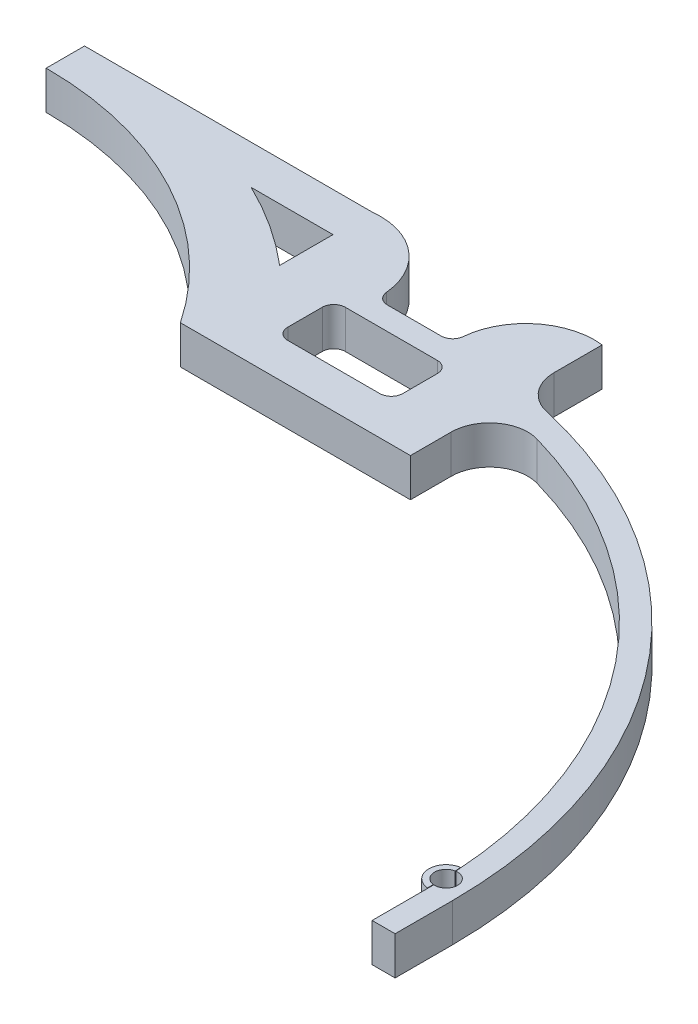
from build123d import *

# Parameters (mm, degrees)
BOSS_EXTRUDE1_DEPTH = 5
BOSS_EXTRUDE2_DEPTH = 10
SKETCH4_R           = 3
CUT_EXTRUDE2_DEPTH  = 7


with BuildPart() as part:
    # Sketch1 → Boss-Extrude1 (new, symmetric)
    with BuildSketch(Plane(origin=(0, 0, 0), x_dir=(1, 0, 0), z_dir=(0, 1, 0))):
        with BuildLine():
            Line((30, 145.200641517), (30, 132.64991519))
            ThreePointArc((30, 132.64991519), (32.187867656, 126.407272462), (37.794117647, 122.896244956))
            ThreePointArc((37.794117647, 122.896244956), (108.370209653, 78.735645376), (135.99984025, 0.200641517))
            Line((135.99984025, 0.200641517), (135.99984025, -14.799358483))
            Line((135.99984025, -14.799358483), (129.999832262, -14.799358483))
            Line((129.999832262, -14.799358483), (129.999832262, 0.200641517))
            ThreePointArc((129.999832262, 0.200641517), (105.666355059, 72.44272572), (42.727272727, 115.450966301))
            ThreePointArc((42.727272727, 115.450966301), (33.969773108, 113.807292795), (30, 105.830052443))
            Line((30, 105.830052443), (30, 95.200641517))
            Line((30, 95.200641517), (-30, 95.200641517))
            ThreePointArc((-30, 95.200641517), (-62.5, 124.575641517), (-105, 135.200641517))
            Line((-105, 135.200641517), (-105, 145.200641517))
            Line((-105, 145.200641517), (-30, 145.200641517))
            ThreePointArc((-30, 145.200641517), (-16.569205688, 141.284017765), (-10, 128.932025452))
            ThreePointArc((-10, 128.932025452), (-9.036173455, 126.986386767), (-7.012049965, 126.200641517))
            Line((-7.012049965, 126.200641517), (7.012049965, 126.200641517))
            ThreePointArc((7.012049965, 126.200641517), (9.036173455, 126.986386767), (10, 128.932025452))
            ThreePointArc((10, 128.932025452), (16.569205688, 141.284017765), (30, 145.200641517))
        make_face()
        with BuildLine():
            Line((-15, 108.200641517), (-15, 117.200641517))
            ThreePointArc((-15, 117.200641517), (-14.121320344, 119.321961861), (-12, 120.200641517))
            Line((-12, 120.200641517), (12, 120.200641517))
            ThreePointArc((12, 120.200641517), (14.121320344, 119.321961861), (15, 117.200641517))
            Line((15, 117.200641517), (15, 108.200641517))
            ThreePointArc((15, 108.200641517), (14.121320344, 106.079321174), (12, 105.200641517))
            Line((12, 105.200641517), (-12, 105.200641517))
            ThreePointArc((-12, 105.200641517), (-14.121320344, 106.079321174), (-15, 108.200641517))
        make_face(mode=Mode.SUBTRACT)
        with BuildLine():
            Line((-51.339377009, 135), (-30, 135))
            Line((-30, 135), (-30, 121.091673029))
            ThreePointArc((-30, 121.091673029), (-40.226437609, 128.725910975), (-51.339377009, 135))
        make_face(mode=Mode.SUBTRACT)
    extrude(amount=BOSS_EXTRUDE1_DEPTH, both=True)


with BuildPart() as body_2:
    # Sketch3 → Boss-Extrude2 (new body)
    with BuildSketch(Plane(origin=(0, 5, 0), x_dir=(1, 0, 0), z_dir=(0, 1, 0))):
        with BuildLine():
            ThreePointArc((129.560346247, 8.724689949), (125.726139097, 4.113923257), (129.878068317, -0.212946017))
            ThreePointArc((129.878068317, -0.212946017), (129.802498492, 4.258832867), (129.560346247, 8.724689949))
        make_face()
    extrude(amount=-BOSS_EXTRUDE2_DEPTH)


with BuildPart() as cut_extrude2_tool:
    # Sketch4 → Cut-Extrude2 (new body)
    with BuildSketch(Plane(origin=(0, 5, 0), x_dir=(1, 0, 0), z_dir=(0, 1, 0))):
        with Locations((130.223298428, 4.273791792)):
            Circle(SKETCH4_R)
    extrude(amount=-CUT_EXTRUDE2_DEPTH)


with BuildPart() as part_1:
    add(part.part)

    # Cut-Extrude2: cut by cut_extrude2_tool
    add(cut_extrude2_tool.part, mode=Mode.SUBTRACT)


with BuildPart() as body_2_1:
    add(body_2.part)

    # Cut-Extrude2: cut by cut_extrude2_tool
    add(cut_extrude2_tool.part, mode=Mode.SUBTRACT)


solid = Compound([part_1.part, body_2_1.part])
